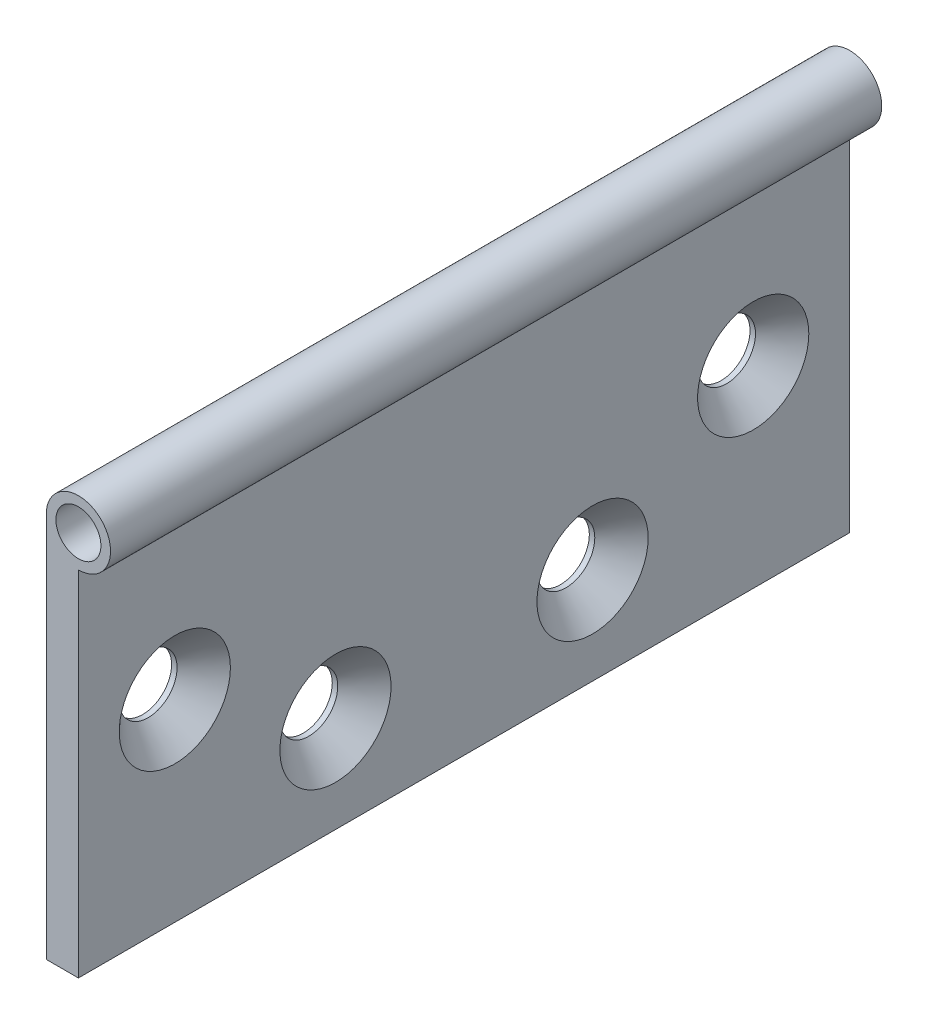
from build123d import *

# Parameters (mm, degrees)
SKETCH_1_W                 = 5
SKETCH_1_H                 = 60
EXTRUDE_1_DEPTH            = 60
SKETCH_2_R                 = 5
SKETCH_4_R                 = 3.5
CUT_EXTRUDE_1_DEPTH        = 137.839321834
HOLE_WIZARD_M81_AT_2_COUNT = 2
HOLE_WIZARD_M81_AT_2_PITCH = 29.154759474


with BuildPart() as part:
    # Эскиз1 → Вытянуть-Тонкостенный1 (new, symmetric)
    with BuildSketch(Plane.XY):
        with Locations((2.5, 30)):
            Rectangle(SKETCH_1_W, SKETCH_1_H)
    extrude(amount=EXTRUDE_1_DEPTH, both=True)

    # По траектории1: sweep along a curve in space
    with BuildLine() as sweep_1_path:
        Line((5, 60, 60), (5, 60, -60))
    # Эскиз2 → По траектории1 (sweep)
    with BuildSketch(Plane.XY.offset(60)):
        with Locations((5, 60)):
            Circle(SKETCH_2_R)
    sweep(path=sweep_1_path.line)

    # Эскиз4 → Вырез-Вытянуть1 (cut, through all)
    with BuildSketch(Plane.XY.offset(60)):
        with Locations((5, 60)):
            Circle(SKETCH_4_R)
    extrude(amount=-CUT_EXTRUDE_1_DEPTH, mode=Mode.SUBTRACT)

    # Эскиз5 → Зенковка для  винта с плоской головкой M81 (revolve, cut)
    with BuildSketch(Plane(origin=(5, 30, 45), x_dir=(0, 0, -1), z_dir=(0, 1, 0))):
        Polygon((0, 0), (0, 5), (4.5, 5), (4.5, 4.15), (8.65, 0), align=None)
    hole_wizard_m81 = revolve(axis=Axis((11.35, 30, 45), (-1, 0, 0)), mode=Mode.SUBTRACT)

    # Зенковка для  винта с плоской головкой M81 at 2: Зенковка для  винта с плоской головкой M81 ×2
    with Locations(*[Vector(0, -0.5144957554275265, -0.8574929257125442) * (i * HOLE_WIZARD_M81_AT_2_PITCH) for i in range(1, HOLE_WIZARD_M81_AT_2_COUNT)]):
        add(hole_wizard_m81, mode=Mode.SUBTRACT)

    # Зеркальное отражение1: Зенковка для  винта с плоской головкой M81 across plane
    add(hole_wizard_m81.mirror(Plane.XY), mode=Mode.SUBTRACT)

    # Зеркальное отражение1 copy 1 sketch → Зеркальное отражение1 copy 1 (revolve, cut)
    with BuildSketch(Plane(origin=(5, 15, -20), x_dir=(0, 0, 1), z_dir=(0, 1, 0))):
        Polygon((0, 0), (0, -5), (4.5, -5), (4.5, -4.15), (8.65, 0), align=None)
    revolve(axis=Axis((11.35, 15, -20), (1, 0, 0)), mode=Mode.SUBTRACT)


solid = part.part
